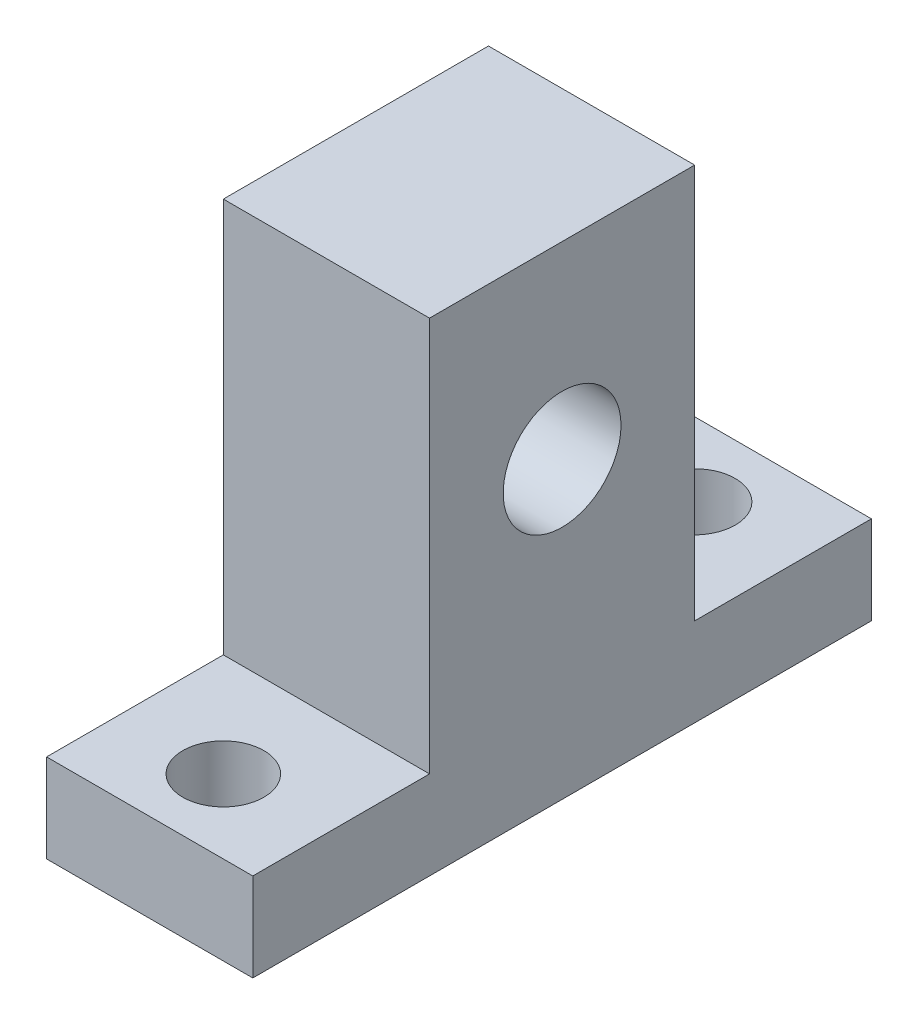
from build123d import *

# Parameters (mm, degrees)
SKETCH_1_R          = 4
EXTRUDE_1_DEPTH     = 14
SKETCH_2_R          = 2.75
CUT_EXTRUDE_1_DEPTH = 14


with BuildPart() as part:
    # 草图1 → 凸台-拉伸1 (new body)
    with BuildSketch(Plane(origin=(0, 0, 0), x_dir=(0, 0, -1), z_dir=(1, 0, 0))):
        Polygon((21, 0), (-21, 0), (-21, 6), (-9, 6), (-9, 32.8), (9, 32.8), (9, 6), (21, 6), align=None)
        with Locations((0, 20)):
            Circle(SKETCH_1_R, mode=Mode.SUBTRACT)
    extrude(amount=EXTRUDE_1_DEPTH)

    # 草图2 → 切除-拉伸1 (cut)
    with BuildSketch(Plane(origin=(0, 6, 0), x_dir=(1, 0, 0), z_dir=(0, 1, 0))):
        with Locations(Location((7, 16, 0), (0, 0, 270))):
            Circle(SKETCH_2_R)
        with Locations(Location((7, -16, 0), (0, 0, 270))):
            Circle(SKETCH_2_R)
    extrude(amount=-CUT_EXTRUDE_1_DEPTH, mode=Mode.SUBTRACT)


solid = part.part
